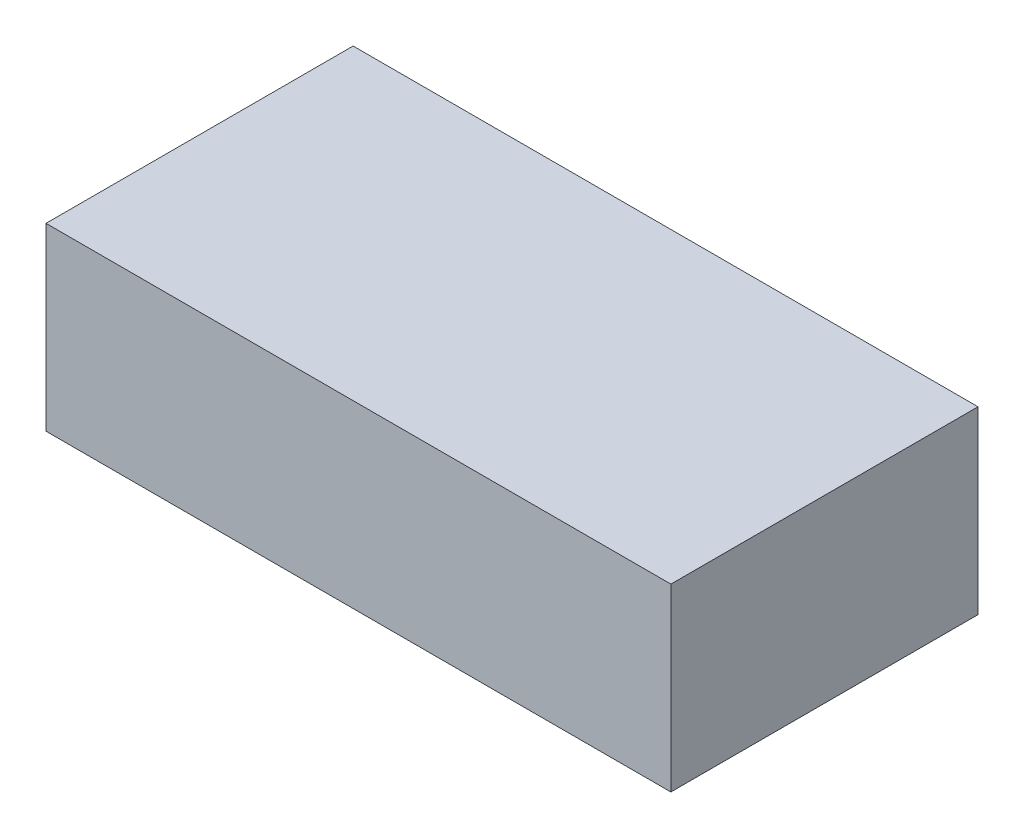
from build123d import *

# Parameters (mm, degrees)
SKETCH_1_W      = 118
SKETCH_1_H      = 58
EXTRUDE_1_DEPTH = 34


with BuildPart() as part:
    # 草图1 → 凸台-拉伸1 (new body)
    with BuildSketch(Plane(origin=(0, 0, 0), x_dir=(1, 0, 0), z_dir=(0, 1, 0))):
        Rectangle(SKETCH_1_W, SKETCH_1_H)
    extrude(amount=EXTRUDE_1_DEPTH)


solid = part.part
